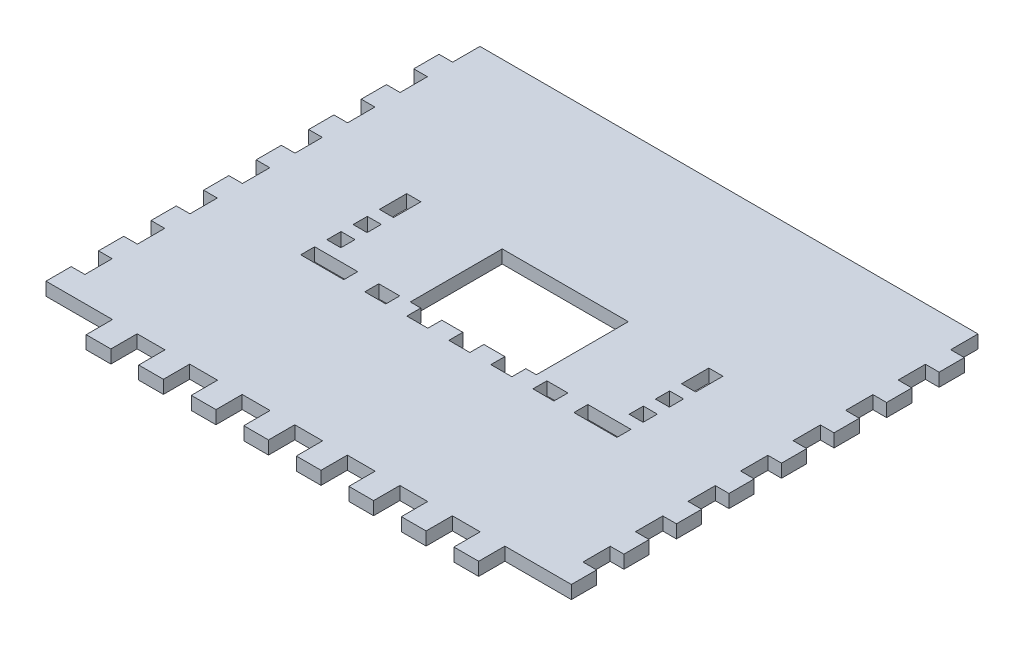
from build123d import *

# Parameters (mm, degrees)
SKETCH1_W           = 127
SKETCH1_H           = 107.95
BOSS_EXTRUDE1_DEPTH = 3.175
SKETCH2_W           = 3.302
SKETCH2_H           = 6.604
CUT_EXTRUDE1_DEPTH  = 84.400427157
SKETCH3_R           = 1.27
SKETCH3_W           = 3.377042817
SKETCH3_H           = 3.429
SKETCH3_W_2         = 3.429
SKETCH3_H_2         = 6.604
SKETCH3_W_3         = 5.08
SKETCH3_H_3         = 3.377042817
SKETCH3_W_4         = 10.414
CUT_EXTRUDE2_DEPTH  = 84.400427157
SKETCH4_W           = 25.4
SKETCH4_H           = 12.7
CUT_EXTRUDE3_DEPTH  = 84.400427157
SKETCH5_W           = 30.48
SKETCH5_H           = 17.475489296
CUT_EXTRUDE4_DEPTH  = 84.400427157
SKETCH6_W           = 30.48
SKETCH6_H           = 22.225
CUT_EXTRUDE5_DEPTH  = 84.400427157


with BuildPart() as part:
    # Sketch1 → Boss-Extrude1 (new body)
    with BuildSketch(Plane(origin=(0, 0, 0), x_dir=(1, 0, 0), z_dir=(0, 1, 0))):
        Rectangle(SKETCH1_W, SKETCH1_H)
    extrude(amount=BOSS_EXTRUDE1_DEPTH)

    # Sketch2 → Cut-Extrude1 (cut, through all)
    with BuildSketch(Plane.XZ):
        Polygon((-34.7345, 47.625), (-41.4655, 47.625), (-41.4655, 54.229), (-47.4345, 54.229), (-47.4345, 47.625), (-60.198, 47.625), (-63.5, 47.625), (-63.5, 54.229), (-63.5, 63.03162391), (63.5, 63.03162391), (63.5, 54.229), (63.5, 47.625), (60.198, 47.625), (47.4345, 47.625), (47.4345, 54.229), (41.4655, 54.229), (41.4655, 47.625), (34.7345, 47.625), (34.7345, 54.229), (28.7655, 54.229), (28.7655, 47.625), (22.0345, 47.625), (22.0345, 54.229), (16.0655, 54.229), (16.0655, 47.625), (9.3345, 47.625), (9.3345, 54.229), (3.3655, 54.229), (3.3655, 47.625), (-3.3655, 47.625), (-3.3655, 54.229), (-9.3345, 54.229), (-9.3345, 47.625), (-16.0655, 47.625), (-16.0655, 54.229), (-22.0345, 54.229), (-22.0345, 47.625), (-28.7655, 47.625), (-28.7655, 54.229), (-34.7345, 54.229), align=None)
        with Locations((61.849, 38.227)):
            Rectangle(SKETCH2_W, SKETCH2_H)
        with Locations((61.849, 25.527)):
            Rectangle(SKETCH2_W, SKETCH2_H)
        with Locations((61.849, 12.827)):
            Rectangle(SKETCH2_W, SKETCH2_H)
        with Locations((61.849, 0.127)):
            Rectangle(SKETCH2_W, SKETCH2_H)
        with Locations((61.849, -12.573)):
            Rectangle(SKETCH2_W, SKETCH2_H)
        with Locations((61.849, -25.273)):
            Rectangle(SKETCH2_W, SKETCH2_H)
        with Locations((61.849, -37.973)):
            Rectangle(SKETCH2_W, SKETCH2_H)
        with Locations((-61.849, -37.973)):
            Rectangle(SKETCH2_W, SKETCH2_H)
        with Locations((-61.849, -25.273)):
            Rectangle(SKETCH2_W, SKETCH2_H)
        with Locations((-61.849, -12.573)):
            Rectangle(SKETCH2_W, SKETCH2_H)
        with Locations((-61.849, 0.127)):
            Rectangle(SKETCH2_W, SKETCH2_H)
        with Locations((-61.849, 12.827)):
            Rectangle(SKETCH2_W, SKETCH2_H)
        with Locations((-61.849, 25.527)):
            Rectangle(SKETCH2_W, SKETCH2_H)
        with Locations((-61.849, 38.227)):
            Rectangle(SKETCH2_W, SKETCH2_H)
        with Locations((61.849, -50.673)):
            Rectangle(SKETCH2_W, SKETCH2_H)
        with Locations((-61.849, -50.673)):
            Rectangle(SKETCH2_W, SKETCH2_H)
    extrude(amount=-CUT_EXTRUDE1_DEPTH, mode=Mode.SUBTRACT)

    # Sketch3 → Cut-Extrude2 (cut, through all)
    with BuildSketch(Plane(origin=(0, 3.175, 0), x_dir=(1, 0, 0), z_dir=(0, 1, 0))):
        with Locations((0, 3.175)):
            Circle(SKETCH3_R)
        with Locations((-36.538478592, -3.289010704)):
            Rectangle(SKETCH3_W, SKETCH3_H)
        with Locations((-36.5125, 10.998489296)):
            Rectangle(SKETCH3_W_2, SKETCH3_H_2)
        with Locations((-36.538478592, 3.060989296)):
            Rectangle(SKETCH3_W, SKETCH3_H)
        with Locations((-10.033, -9.639010705)):
            Rectangle(SKETCH3_W_3, SKETCH3_H_3)
        with Locations((-33.02, -9.639010705)):
            Rectangle(SKETCH3_W_4, SKETCH3_H_3)
        with Locations((-20.193, -9.639010705)):
            Rectangle(SKETCH3_W_3, SKETCH3_H_3)
        with Locations((0.127, -9.639010705)):
            Rectangle(SKETCH3_W_3, SKETCH3_H_3)
        with Locations((10.287, -9.639010705)):
            Rectangle(SKETCH3_W_3, SKETCH3_H_3)
        with Locations((20.447, -9.639010705)):
            Rectangle(SKETCH3_W_3, SKETCH3_H_3)
        with Locations((33.02, -9.639010705)):
            Rectangle(SKETCH3_W_4, SKETCH3_H_3)
        with Locations((36.538478592, -3.289010704)):
            Rectangle(SKETCH3_W, SKETCH3_H)
        with Locations((36.538478592, 3.060989296)):
            Rectangle(SKETCH3_W, SKETCH3_H)
        with Locations((36.5125, 10.998489296)):
            Rectangle(SKETCH3_W_2, SKETCH3_H_2)
    extrude(amount=-CUT_EXTRUDE2_DEPTH, mode=Mode.SUBTRACT)

    # Sketch4 → Cut-Extrude3 (cut, through all)
    with BuildSketch(Plane(origin=(0, 3.175, 0), x_dir=(1, 0, 0), z_dir=(0, 1, 0))):
        with Locations((0, 3.175)):
            Rectangle(SKETCH4_W, SKETCH4_H)
    extrude(amount=-CUT_EXTRUDE3_DEPTH, mode=Mode.SUBTRACT)

    # Sketch5 → Cut-Extrude4 (cut, through all)
    with BuildSketch(Plane(origin=(0, 3.175, 0), x_dir=(1, 0, 0), z_dir=(0, 1, 0))):
        with Locations((0.127, 0.787255352)):
            Rectangle(SKETCH5_W, SKETCH5_H)
    extrude(amount=-CUT_EXTRUDE4_DEPTH, mode=Mode.SUBTRACT)

    # Sketch6 → Cut-Extrude5 (cut, through all)
    with BuildSketch(Plane(origin=(0, 3.175, 0), x_dir=(1, 0, 0), z_dir=(0, 1, 0))):
        with Locations((0.127, 3.162010704)):
            Rectangle(SKETCH6_W, SKETCH6_H)
    extrude(amount=-CUT_EXTRUDE5_DEPTH, mode=Mode.SUBTRACT)


solid = part.part
